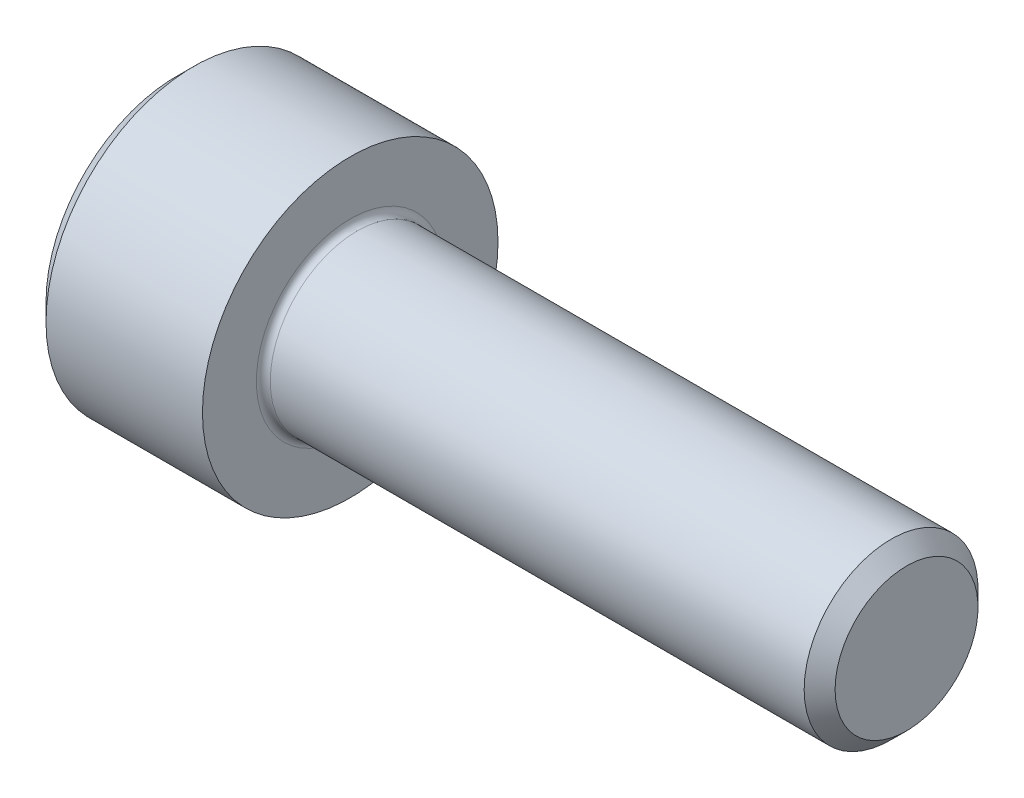
from build123d import *

# Parameters (mm, degrees)
FILLET1_R = 0.2


with BuildPart() as part:
    # BodySke → Base-Revolve (revolve)
    with BuildSketch(Plane.XY):
        Polygon((0, 0), (0, 3.75), (0.5, 4.25), (5, 4.25), (5, 2.5), (20.555, 2.5), (21, 2.055), (21, 0), align=None)
    revolve(axis=Axis((-31.75, 0, 0), (1, 0, 0)))

    # Fillet1
    fillet1_edges = [part.edges().sort_by_distance(p)[0] for p in [
        (5, -2.5, 0),
    ]]
    fillet(fillet1_edges, radius=FILLET1_R)


solid = part.part
